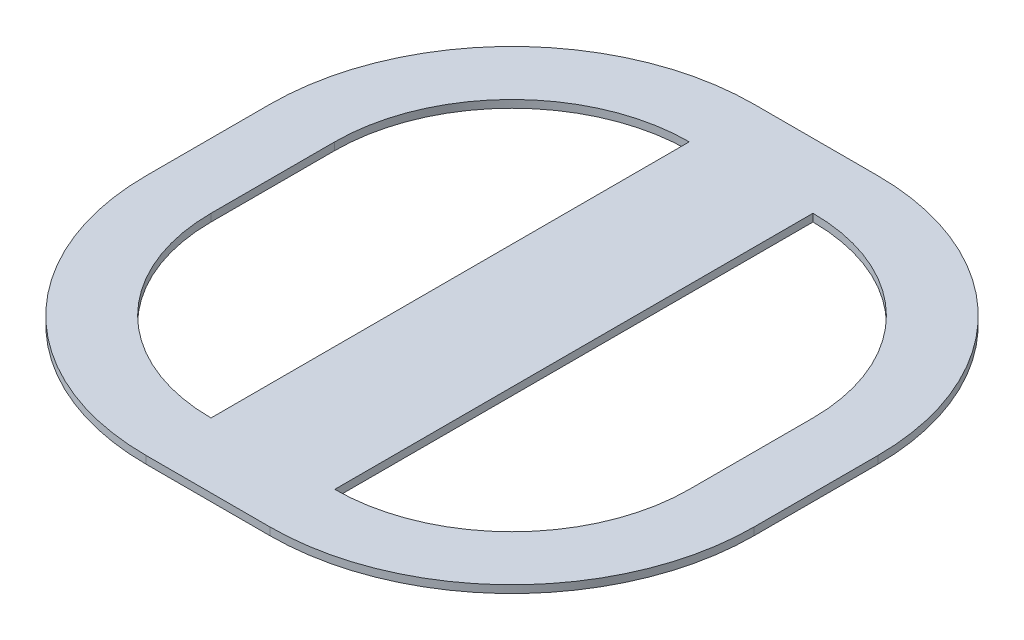
from build123d import *

# Parameters (mm, degrees)
BOSS_EXTRUDE1_DEPTH = 1.175
BOSS_EXTRUDE2_REACH = 127.575
SKETCH4_W           = 19.05
SKETCH4_H           = 1.175


with BuildPart() as part:
    # Sketch1 → Boss-Extrude1 (new body)
    with BuildSketch(Plane(origin=(0, 0, 0), x_dir=(1, 0, 0), z_dir=(0, 1, 0))):
        with BuildLine():
            Line((0, 0), (0, 19.05))
            ThreePointArc((0, 19.05), (10.924917062, 45.425082938), (37.3, 56.35))
            Line((37.3, 56.35), (56.35, 56.35))
            ThreePointArc((56.35, 56.35), (82.725082938, 45.425082938), (93.65, 19.05))
            Line((93.65, 19.05), (93.65, 0))
            ThreePointArc((93.65, 0), (82.725082938, -26.375082938), (56.35, -37.3))
            Line((56.35, -37.3), (37.3, -37.3))
            ThreePointArc((37.3, -37.3), (10.924917062, -26.375082938), (0, 0))
        make_face()
        with BuildLine():
            Line((10, 0), (10, 19.05))
            ThreePointArc((10, 19.05), (17.995984874, 38.354015126), (37.3, 46.35))
            Line((37.3, 46.35), (56.35, 46.35))
            ThreePointArc((56.35, 46.35), (75.654015126, 38.354015126), (83.65, 19.05))
            Line((83.65, 19.05), (83.65, 0))
            ThreePointArc((83.65, 0), (75.654015126, -19.304015126), (56.35, -27.3))
            Line((56.35, -27.3), (37.3, -27.3))
            ThreePointArc((37.3, -27.3), (17.995984874, -19.304015126), (10, 0))
        make_face(mode=Mode.SUBTRACT)
    extrude(amount=BOSS_EXTRUDE1_DEPTH)

    # Boss-Extrude2: up to this face of the body (flat: up to its plane)
    boss_extrude2_end = Plane(part.part.faces().sort_by_distance((46.825, 0.5875, 27.3))[0])
    # Sketch4 → Boss-Extrude2 (add, up to the picked face)
    with BuildSketch(Plane.XY.offset(-46.35), mode=Mode.PRIVATE) as boss_extrude2_sk1:
        with Locations((46.825, 0.5875)):
            Rectangle(SKETCH4_W, SKETCH4_H)
    boss_extrude2_tool1 = split(extrude(boss_extrude2_sk1.sketch, amount=BOSS_EXTRUDE2_REACH, mode=Mode.PRIVATE), bisect_by=boss_extrude2_end, keep=Keep.BOTH, mode=Mode.PRIVATE)
    add(boss_extrude2_tool1.solids().sort_by(Axis((46.825, 0.5875, -46.35), (0, 0, 1)))[0])


solid = part.part
